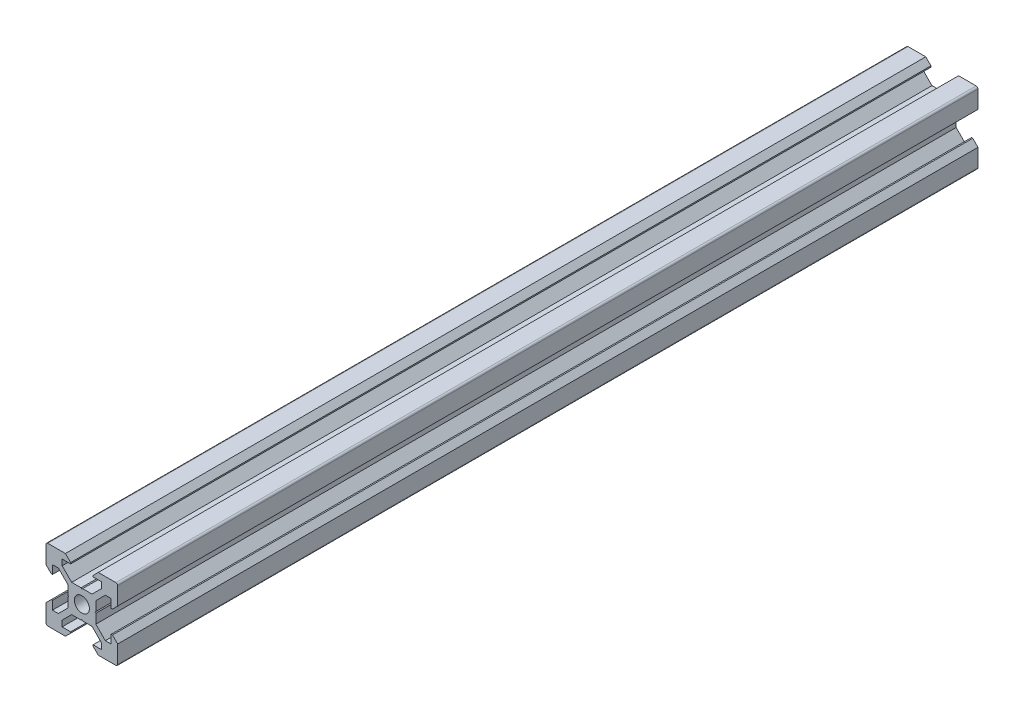
from build123d import *

# Parameters (mm, degrees)
SKETCH1_R           = 2.1
BOSS_EXTRUDE1_DEPTH = 240


with BuildPart() as part:
    # Sketch1 → Boss-Extrude1 (new body)
    with BuildSketch(Plane.XY):
        with BuildLine():
            Line((4.58, -10), (9.5, -10))
            ThreePointArc((9.5, -10), (9.853553391, -9.853553391), (10, -9.5))
            Line((10, -9.5), (10, -4.58))
            Line((10, -4.58), (8.545, -3.125))
            Line((8.545, -3.125), (8.2, -3.125))
            Line((8.2, -3.125), (8.2, -5.5))
            Line((8.2, -5.5), (6.560660172, -5.5))
            Line((6.560660172, -5.5), (3.9, -2.839339828))
            Line((3.9, -2.839339828), (3.9, -0.21))
            Line((3.9, -0.21), (3.69, 0))
            Line((3.69, 0), (3.9, 0.21))
            Line((3.9, 0.21), (3.9, 2.839339828))
            Line((3.9, 2.839339828), (6.560660172, 5.5))
            Line((6.560660172, 5.5), (8.2, 5.5))
            Line((8.2, 5.5), (8.2, 3.125))
            Line((8.2, 3.125), (8.545, 3.125))
            Line((8.545, 3.125), (10, 4.58))
            Line((10, 4.58), (10, 9.5))
            ThreePointArc((10, 9.5), (9.853553391, 9.853553391), (9.5, 10))
            Line((9.5, 10), (4.58, 10))
            Line((4.58, 10), (3.125, 8.545))
            Line((3.125, 8.545), (3.125, 8.2))
            Line((3.125, 8.2), (5.5, 8.2))
            Line((5.5, 8.2), (5.5, 6.560660172))
            Line((5.5, 6.560660172), (2.839339828, 3.9))
            Line((2.839339828, 3.9), (0.21, 3.9))
            Line((0.21, 3.9), (0, 3.69))
            Line((0, 3.69), (-0.21, 3.9))
            Line((-0.21, 3.9), (-2.839339828, 3.9))
            Line((-2.839339828, 3.9), (-5.5, 6.560660172))
            Line((-5.5, 6.560660172), (-5.5, 8.2))
            Line((-5.5, 8.2), (-3.125, 8.2))
            Line((-3.125, 8.2), (-3.125, 8.545))
            Line((-3.125, 8.545), (-4.58, 10))
            Line((-4.58, 10), (-9.5, 10))
            ThreePointArc((-9.5, 10), (-9.853553391, 9.853553391), (-10, 9.5))
            Line((-10, 9.5), (-10, 4.58))
            Line((-10, 4.58), (-8.545, 3.125))
            Line((-8.545, 3.125), (-8.2, 3.125))
            Line((-8.2, 3.125), (-8.2, 5.5))
            Line((-8.2, 5.5), (-6.560660172, 5.5))
            Line((-6.560660172, 5.5), (-3.9, 2.839339828))
            Line((-3.9, 2.839339828), (-3.9, 0.21))
            Line((-3.9, 0.21), (-3.69, 0))
            Line((-3.69, 0), (-3.9, -0.21))
            Line((-3.9, -0.21), (-3.9, -2.839339828))
            Line((-3.9, -2.839339828), (-6.560660172, -5.5))
            Line((-6.560660172, -5.5), (-8.2, -5.5))
            Line((-8.2, -5.5), (-8.2, -3.125))
            Line((-8.2, -3.125), (-8.545, -3.125))
            Line((-8.545, -3.125), (-10, -4.58))
            Line((-10, -4.58), (-10, -9.5))
            ThreePointArc((-10, -9.5), (-9.853553391, -9.853553391), (-9.5, -10))
            Line((-9.5, -10), (-4.58, -10))
            Line((-4.58, -10), (-3.125, -8.545))
            Line((-3.125, -8.545), (-3.125, -8.2))
            Line((-3.125, -8.2), (-5.5, -8.2))
            Line((-5.5, -8.2), (-5.5, -6.560660172))
            Line((-5.5, -6.560660172), (-2.839339828, -3.9))
            Line((-2.839339828, -3.9), (-0.21, -3.9))
            Line((-0.21, -3.9), (0, -3.69))
            Line((0, -3.69), (0.21, -3.9))
            Line((0.21, -3.9), (2.839339828, -3.9))
            Line((2.839339828, -3.9), (5.5, -6.560660172))
            Line((5.5, -6.560660172), (5.5, -8.2))
            Line((5.5, -8.2), (3.125, -8.2))
            Line((3.125, -8.2), (3.125, -8.545))
            Line((3.125, -8.545), (4.58, -10))
        make_face()
        Circle(SKETCH1_R, mode=Mode.SUBTRACT)
    extrude(amount=BOSS_EXTRUDE1_DEPTH)


solid = part.part
